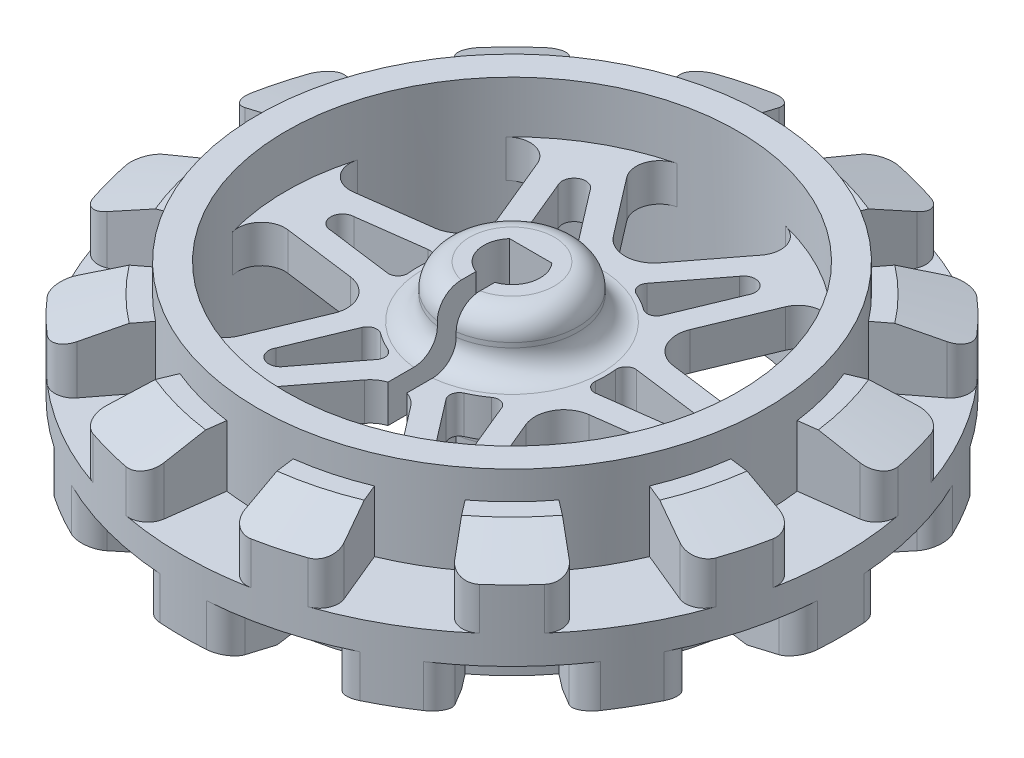
from build123d import *

# Parameters (mm, degrees)
BOSS_EXTRUDE1_DEPTH      = 5.5
BOSS_EXTRUDE1_DEPTH_BACK = 5.5
SKETCH1_R                = 17.5
SKETCH3_R                = 12
CUT_EXTRUDE1_DEPTH       = 2.75
CUT_EXTRUDE6_START       = -6.25
SKETCH10_R               = 12
CUT_EXTRUDE6_DEPTH       = 6.25
SKETCH8_R                = 17.5
SKETCH8_R_2              = 13.5
CUT_EXTRUDE4_DEPTH       = 1.5
SKETCH9_R                = 17.5
CUT_EXTRUDE5_DEPTH       = 1.5
CHAMFER1_SIZE            = 1
CHAMFER1_SIZE2           = 3
CUT_EXTRUDE2_DEPTH       = 4.75
CUT_EXTRUDE3_DEPTH       = 3.25
FILLET1_R                = 1
CIRPATTERN1_COUNT        = 12
FILLET1_OF_CIRPATTERN1_R = 1
CUT_EXTRUDE7_REACH       = 27.653
CUT_EXTRUDE14_REACH      = 27.653
CIRPATTERN2_COUNT        = 6
CUT_EXTRUDE15_REACH      = 27.653
BOSS_EXTRUDE2_START      = 2.75
BOSS_EXTRUDE2_DEPTH      = 2.75
BOSS_EXTRUDE3_DEPTH      = 3.75
FILLET2_R                = 1.25


with BuildPart() as part:
    # Sketch1 → Boss-Extrude1 (new, two sides: drawn at the far end of the back side and taken through both)
    with BuildSketch(Plane(origin=(0, 0, 0), x_dir=(1, 0, 0), z_dir=(0, 1, 0)).offset(-BOSS_EXTRUDE1_DEPTH_BACK)):
        with Locations(Location((0, 0, 0), (0, 0, 270))):
            Circle(SKETCH1_R)
    extrude(amount=BOSS_EXTRUDE1_DEPTH + BOSS_EXTRUDE1_DEPTH_BACK)

    # Sketch3 → Cut-Extrude1 (cut)
    with BuildSketch(Plane(origin=(0, 5.5, 0), x_dir=(1, 0, 0), z_dir=(0, 1, 0))):
        with Locations(Location((0, 0, 0), (0, 0, 270))):
            Circle(SKETCH3_R)
    extrude(amount=-CUT_EXTRUDE1_DEPTH, mode=Mode.SUBTRACT)

    # Sketch10 → Cut-Extrude6 (cut)
    with BuildSketch(Plane(origin=(0, -5.5, 0), x_dir=(-1, 0, 0), z_dir=(0, -1, 0)).offset(CUT_EXTRUDE6_START)):
        with Locations(Location((0, 0, 0), (0, 0, 270))):
            Circle(SKETCH10_R)
    extrude(amount=CUT_EXTRUDE6_DEPTH, mode=Mode.SUBTRACT)

    # Sketch8 → Cut-Extrude4 (cut)
    with BuildSketch(Plane(origin=(0, 5.5, 0), x_dir=(1, 0, 0), z_dir=(0, 1, 0))):
        with Locations(Location((0, 0, 0), (0, 0, 270))):
            Circle(SKETCH8_R)
        with Locations(Location((0, 0, 0), (0, 0, 270))):
            Circle(SKETCH8_R_2, mode=Mode.SUBTRACT)
    extrude(amount=-CUT_EXTRUDE4_DEPTH, mode=Mode.SUBTRACT)

    # Sketch9 → Cut-Extrude5 (cut)
    with BuildSketch(Plane(origin=(0, -5.5, 0), x_dir=(-1, 0, 0), z_dir=(0, -1, 0))):
        with Locations(Location((0, 0, 0), (0, 0, 270))):
            Circle(SKETCH9_R)
    extrude(amount=-CUT_EXTRUDE5_DEPTH, mode=Mode.SUBTRACT)

    # Chamfer1
    chamfer1_edges = [part.edges().sort_by_distance(p)[0] for p in [
        (0, 4, -17.5),
        (0, -4, -17.5),
    ]]
    chamfer1_side = [part.faces().sort_by_distance(p)[0] for p in [
        (0, 0, -17.5),
    ]]
    chamfer(chamfer1_edges, length=CHAMFER1_SIZE, length2=CHAMFER1_SIZE2, reference=chamfer1_side[0])

    # Sketch4 → Cut-Extrude2 (cut)
    with BuildSketch(Plane(origin=(0, 5.5, 0), x_dir=(1, 0, 0), z_dir=(0, 1, 0))):
        with BuildLine():
            Line((5.166226337, 12.472373689), (6.696960066, 16.167891819))
            ThreePointArc((6.696960066, 16.167891819), (8.75, 15.155444566), (10.653325008, 13.883683455))
            Line((10.653325008, 13.883683455), (8.218279292, 10.710270094))
            ThreePointArc((8.218279292, 10.710270094), (6.75, 11.691342951), (5.166226337, 12.472373689))
        make_face()
    cut_extrude2 = extrude(amount=-CUT_EXTRUDE2_DEPTH, mode=Mode.SUBTRACT)

    # Sketch7 → Cut-Extrude3 (cut)
    with BuildSketch(Plane(origin=(0, -4, 0), x_dir=(-1, 0, 0), z_dir=(0, -1, 0))):
        with BuildLine():
            Line((-1.762103595, 13.384505629), (-2.284208364, 17.350285074))
            ThreePointArc((-2.284208364, 17.350285074), (-4.529333289, 16.90370196), (-6.696960066, 16.167891819))
            Line((-6.696960066, 16.167891819), (-5.166226337, 12.472373689))
            ThreePointArc((-5.166226337, 12.472373689), (-3.494057109, 13.039998655), (-1.762103595, 13.384505629))
        make_face()
    cut_extrude3 = extrude(amount=-CUT_EXTRUDE3_DEPTH, mode=Mode.SUBTRACT)

    # Fillet1
    fillet1_edges = [part.edges().sort_by_distance(p)[0] for p in [
        (6.696960066, 1.875, -16.167891819),
        (10.653325008, 1.875, -13.883683455),
        (6.696960066, -1.875, -16.167891819),
        (2.284208364, -1.875, -17.350285074),
    ]]
    fillet(fillet1_edges, radius=FILLET1_R)

    # CirPattern1: Cut-Extrude2, Cut-Extrude3 ×12 about axis
    cirpattern1_axis = Axis((0, 0, 0), (0, 1, 0))
    add([cut_extrude2.rotate(cirpattern1_axis, i * 360 / CIRPATTERN1_COUNT) for i in range(1, CIRPATTERN1_COUNT)], mode=Mode.SUBTRACT)
    add([cut_extrude3.rotate(cirpattern1_axis, i * 360 / CIRPATTERN1_COUNT) for i in range(1, CIRPATTERN1_COUNT)], mode=Mode.SUBTRACT)

    # Fillet1 of CirPattern1
    fillet1_of_cirpattern1_edges = [part.edges().sort_by_distance(p)[0] for p in [
        (-2.284208364, 1.875, -17.350285074),
        (2.284208364, 1.875, -17.350285074),
        (-2.284208364, -1.875, -17.350285074),
        (-6.696960066, -1.875, -16.167891819),
        (-10.653325008, 1.875, -13.883683455),
        (-6.696960066, 1.875, -16.167891819),
        (-10.653325008, -1.875, -13.883683455),
        (-13.883683455, -1.875, -10.653325008),
        (-16.167891819, 1.875, -6.696960066),
        (-13.883683455, 1.875, -10.653325008),
        (-16.167891819, -1.875, -6.696960066),
        (-17.350285074, -1.875, -2.284208364),
        (-17.350285074, 1.875, 2.284208364),
        (-17.350285074, 1.875, -2.284208364),
        (-17.350285074, -1.875, 2.284208364),
        (-16.167891819, -1.875, 6.696960066),
        (-13.883683455, 1.875, 10.653325008),
        (-16.167891819, 1.875, 6.696960066),
        (-13.883683455, -1.875, 10.653325008),
        (-10.653325008, -1.875, 13.883683455),
        (-6.696960066, 1.875, 16.167891819),
        (-10.653325008, 1.875, 13.883683455),
        (-6.696960066, -1.875, 16.167891819),
        (-2.284208364, -1.875, 17.350285074),
        (2.284208364, 1.875, 17.350285074),
        (-2.284208364, 1.875, 17.350285074),
        (2.284208364, -1.875, 17.350285074),
        (6.696960066, -1.875, 16.167891819),
        (10.653325008, 1.875, 13.883683455),
        (6.696960066, 1.875, 16.167891819),
        (10.653325008, -1.875, 13.883683455),
        (13.883683455, -1.875, 10.653325008),
        (16.167891819, 1.875, 6.696960066),
        (13.883683455, 1.875, 10.653325008),
        (16.167891819, -1.875, 6.696960066),
        (17.350285074, -1.875, 2.284208364),
        (17.350285074, 1.875, -2.284208364),
        (17.350285074, 1.875, 2.284208364),
        (17.350285074, -1.875, -2.284208364),
        (16.167891819, -1.875, -6.696960066),
        (13.883683455, 1.875, -10.653325008),
        (16.167891819, 1.875, -6.696960066),
        (13.883683455, -1.875, -10.653325008),
        (10.653325008, -1.875, -13.883683455),
    ]]
    fillet(fillet1_of_cirpattern1_edges, radius=FILLET1_OF_CIRPATTERN1_R)

    # Sketch12 → Cut-Extrude7 (cut, up to next)
    with BuildSketch(Plane(origin=(0, 2.75, 0), x_dir=(1, 0, 0), z_dir=(0, 1, 0)), mode=Mode.PRIVATE) as cut_extrude7_sk1:
        with BuildLine():
            Line((3.578117269, 9.673266088), (1.221888194, 6.602568574))
            ThreePointArc((1.221888194, 6.602568574), (0, 6), (-1.221888194, 6.602568574))
            Line((-1.221888194, 6.602568574), (-3.578117269, 9.673266088))
            ThreePointArc((-3.578117269, 9.673266088), (-3.766255436, 10.847136199), (-2.887172755, 11.647499023))
            ThreePointArc((-2.887172755, 11.647499023), (-1.454305973, 11.911548771), (0, 12))
            ThreePointArc((0, 12), (1.454305973, 11.911548771), (2.887172755, 11.647499023))
            ThreePointArc((2.887172755, 11.647499023), (3.766255436, 10.847136199), (3.578117269, 9.673266088))
        make_face()
    cut_extrude7_tool1 = extrude(cut_extrude7_sk1.sketch, amount=-CUT_EXTRUDE7_REACH, mode=Mode.PRIVATE) & part.part
    cut_extrude7 = cut_extrude7_tool1.solids().sort_by_distance((0, 2.75, -9.497867))[0]
    add(cut_extrude7, mode=Mode.SUBTRACT)

    # Sketch14 → Cut-Extrude14 (cut, up to next)
    with BuildSketch(Plane(origin=(0, 2.75, 0), x_dir=(1, 0, 0), z_dir=(0, 1, 0)), mode=Mode.PRIVATE) as cut_extrude14_sk1:
        with BuildLine():
            Line((3.703863661, 4.251622323), (5.043255675, 7.485200687))
            ThreePointArc((5.043255675, 7.485200687), (4.8125, 8.335494511), (3.96074611, 8.110187876))
            Line((3.96074611, 8.110187876), (1.830081109, 5.333451185))
            ThreePointArc((1.830081109, 5.333451185), (1.742268595, 4.905497695), (2.024325254, 4.571882246))
            ThreePointArc((2.024325254, 4.571882246), (2.5, 4.330127019), (2.947203541, 4.039058218))
            ThreePointArc((2.947203541, 4.039058218), (3.377151325, 3.961597711), (3.703863661, 4.251622323))
        make_face()
    cut_extrude14_tool1 = extrude(cut_extrude14_sk1.sketch, amount=-CUT_EXTRUDE14_REACH, mode=Mode.PRIVATE) & part.part
    cut_extrude14 = cut_extrude14_tool1.solids().sort_by_distance((3.510647, 2.75, -6.080619))[0]
    add(cut_extrude14, mode=Mode.SUBTRACT)

    # CirPattern2: Cut-Extrude7, Cut-Extrude14 ×6 about axis
    cirpattern2_axis = Axis((0, 0, 0), (0, 1, 0))
    add([cut_extrude7.rotate(cirpattern2_axis, i * 360 / CIRPATTERN2_COUNT) for i in range(1, CIRPATTERN2_COUNT)], mode=Mode.SUBTRACT)
    add([cut_extrude14.rotate(cirpattern2_axis, i * 360 / CIRPATTERN2_COUNT) for i in range(1, CIRPATTERN2_COUNT)], mode=Mode.SUBTRACT)

    # Sketch15 → Cut-Extrude15 (cut, up to next)
    with BuildSketch(Plane(origin=(0, 2.75, 0), x_dir=(1, 0, 0), z_dir=(0, 1, 0)), mode=Mode.PRIVATE) as cut_extrude15_sk1:
        with BuildLine():
            Line((-0.5, -1.414213562), (-0.5, -6.083419729))
            ThreePointArc((-0.5, -6.083419729), (0, -6), (0.5, -6.083419729))
            Line((0.5, -6.083419729), (0.5, -1.414213562))
            ThreePointArc((0.5, -1.414213562), (1.451830142, -0.377079885), (1.125, 0.992156742))
            Line((1.125, 0.992156742), (-1.125, 0.992156742))
            ThreePointArc((-1.125, 0.992156742), (-1.451830142, -0.377079885), (-0.5, -1.414213562))
        make_face()
    cut_extrude15_tool1 = extrude(cut_extrude15_sk1.sketch, amount=-CUT_EXTRUDE15_REACH, mode=Mode.PRIVATE) & part.part
    add(cut_extrude15_tool1.solids().sort_by_distance((0, 2.75, 1.664598))[0], mode=Mode.SUBTRACT)

    # Sketch16 → Boss-Extrude2 (add)
    with BuildSketch(Plane(origin=(0, 2.75, 0), x_dir=(1, 0, 0), z_dir=(0, 1, 0)).offset(BOSS_EXTRUDE2_START)):
        with BuildLine():
            Line((-0.5, -3.464101615), (-0.5, -1.414213562))
            ThreePointArc((-0.5, -1.414213562), (-1.451830142, -0.377079885), (-1.125, 0.992156742))
            Line((-1.125, 0.992156742), (1.125, 0.992156742))
            ThreePointArc((1.125, 0.992156742), (1.451830142, -0.377079885), (0.5, -1.414213562))
            Line((0.5, -1.414213562), (0.5, -3.464101615))
            ThreePointArc((0.5, -3.464101615), (0, 3.5), (-0.5, -3.464101615))
        make_face()
    extrude(amount=-BOSS_EXTRUDE2_DEPTH)

    # Sketch17 → Boss-Extrude3 (add)
    with BuildSketch(Plane(origin=(0, 0.75, 0), x_dir=(-1, 0, 0), z_dir=(0, -1, 0))):
        with BuildLine():
            Line((0.5, -3.464101615), (0.5, -1.414213562))
            ThreePointArc((0.5, -1.414213562), (1.451830142, -0.377079885), (1.125, 0.992156742))
            Line((1.125, 0.992156742), (-1.125, 0.992156742))
            ThreePointArc((-1.125, 0.992156742), (-1.451830142, -0.377079885), (-0.5, -1.414213562))
            Line((-0.5, -1.414213562), (-0.5, -3.464101615))
            ThreePointArc((-0.5, -3.464101615), (0, 3.5), (0.5, -3.464101615))
        make_face()
    extrude(amount=BOSS_EXTRUDE3_DEPTH)

    # Fillet2
    fillet2_edges = [part.edges().sort_by_distance(p)[0] for p in [
        (0, 2.75, -3.5),
        (0, 5.5, -3.5),
        (0, 0.75, -3.5),
        (0, -3, -3.5),
    ]]
    fillet(fillet2_edges, radius=FILLET2_R)


solid = part.part
